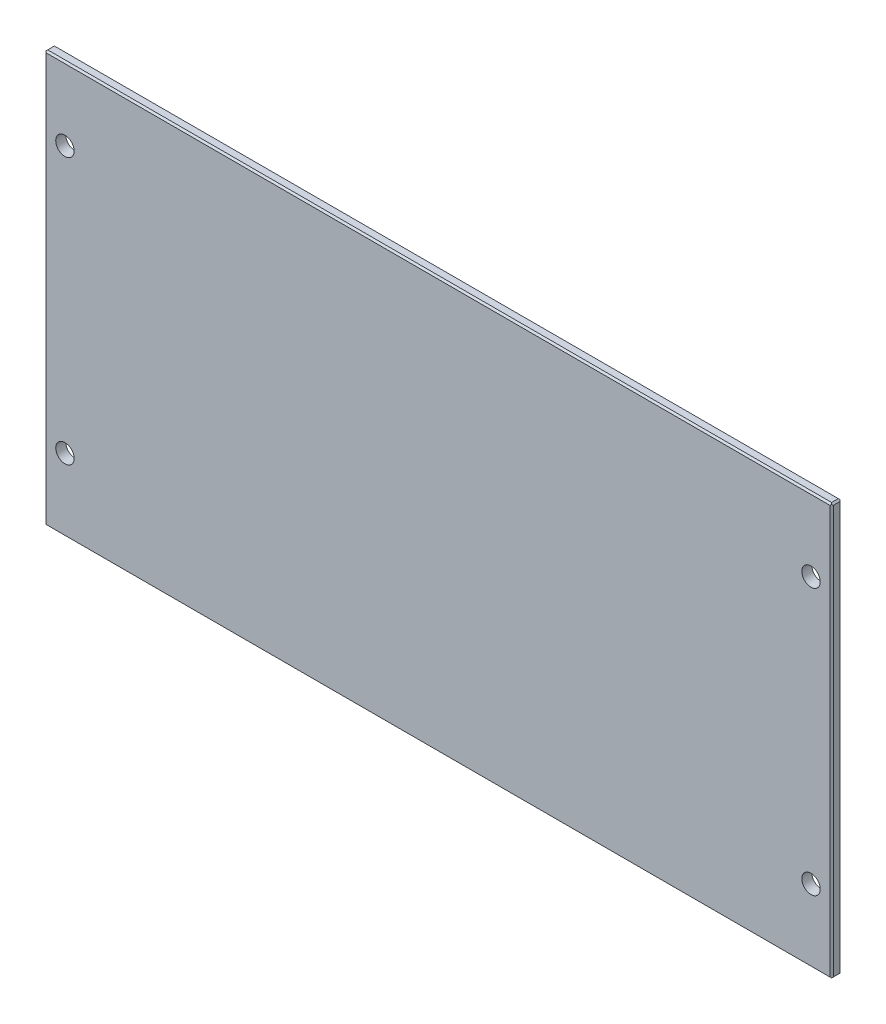
from build123d import *

# Parameters (mm, degrees)
SKETCH1_W           = 235.13
SKETCH1_H           = 123
BOSS_EXTRUDE1_DEPTH = 3
SKETCH2_R           = 2.75
CUT_EXTRUDE1_DEPTH  = 133.713146391
CHAMFER1_SIZE       = 0.5
CHAMFER2_SIZE       = 0.5


with BuildPart() as part:
    # Sketch1 → Boss-Extrude1 (new body)
    with BuildSketch(Plane.XY):
        Rectangle(SKETCH1_W, SKETCH1_H)
    extrude(amount=BOSS_EXTRUDE1_DEPTH)

    # Sketch2 → Cut-Extrude1 (cut, through all)
    with BuildSketch(Plane.XY.offset(3)):
        with Locations((-111.415, 39.75)):
            Circle(SKETCH2_R)
        with Locations(Location((-111.415, -39.75, 0), (0, 0, 180))):
            Circle(SKETCH2_R)
        with Locations((111.415, -39.75)):
            Circle(SKETCH2_R)
        with Locations(Location((111.415, 39.75, 0), (0, 0, 180))):
            Circle(SKETCH2_R)
    extrude(amount=-CUT_EXTRUDE1_DEPTH, mode=Mode.SUBTRACT)

    # Chamfer1
    chamfer1_edges = [part.edges().sort_by_distance(p)[0] for p in [
        (-117.565, 0, 3),
        (0, -61.5, 3),
        (117.565, 0, 3),
        (0, -61.5, 0),
        (-117.565, 0, 0),
        (0, 61.5, 0),
        (117.565, 0, 0),
        (0, 61.5, 3),
    ]]
    chamfer(chamfer1_edges, length=CHAMFER1_SIZE)

    # Chamfer2
    chamfer2_edges = [part.edges().sort_by_distance(p)[0] for p in [
        (117.565, -61.5, 1.5),
        (-117.565, -61.5, 1.5),
        (-117.565, 61.5, 1.5),
        (117.565, 61.5, 1.5),
    ]]
    chamfer(chamfer2_edges, length=CHAMFER2_SIZE)


solid = part.part
